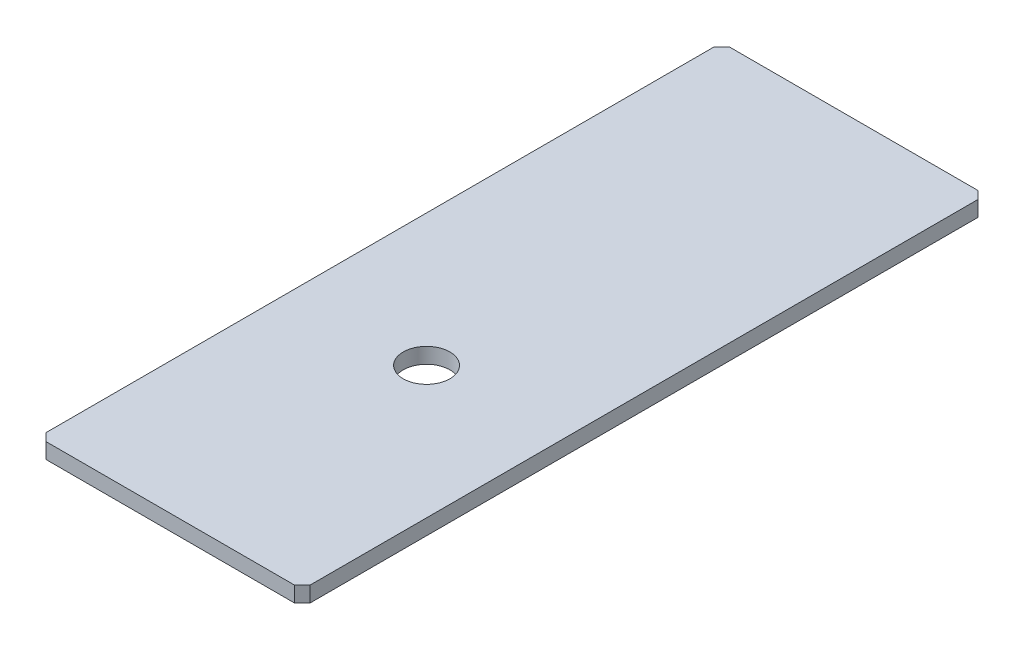
from build123d import *

# Parameters (mm, degrees)
CROQUIS1_R              = 1.5
SALIENTE_EXTRUIR1_DEPTH = 1


with BuildPart() as part:
    # Croquis1 → Saliente-Extruir1 (new body)
    with BuildSketch(Plane(origin=(0, 0, 0), x_dir=(1, 0, 0), z_dir=(0, 1, 0))):
        Polygon((8, 22), (8.5, 21.5), (8.5, -21.5), (8, -22), (-8, -22), (-8.5, -21.5), (-8.5, 21.5), (-8, 22), align=None)
        with Locations(Location((0, -5.5, 0), (0, 0, 270))):
            Circle(CROQUIS1_R, mode=Mode.SUBTRACT)
    extrude(amount=SALIENTE_EXTRUIR1_DEPTH)


solid = part.part
